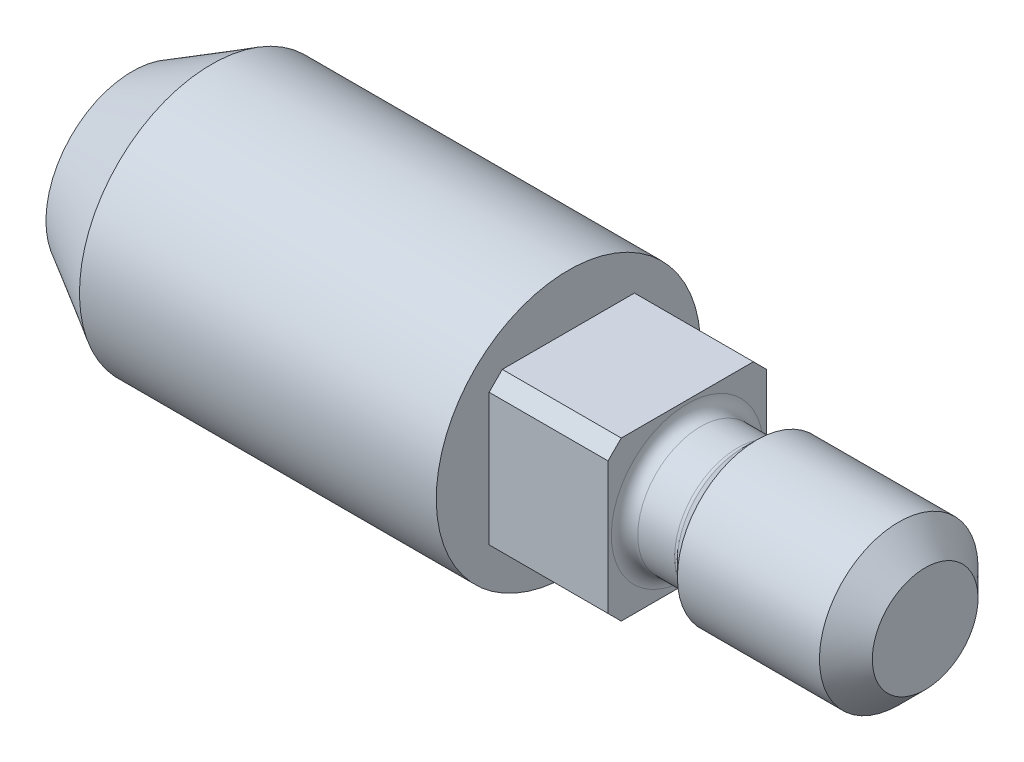
from build123d import *

# Parameters (mm, degrees)
SKETCH_2_W      = 12
SKETCH_2_H      = 12
EXTRUDE_1_DEPTH = 9
CHAMFER_1_SIZE  = 1
FILLET_1_R      = 1
FILLET_2_R      = 0.5
CHAMFER_2_SIZE  = 2


with BuildPart() as part:
    # Эскиз1 → Повернуть1 (revolve)
    with BuildSketch(Plane.XY, mode=Mode.PRIVATE) as revolve_1_sk:
        with BuildLine():
            Line((0, 6), (0, 6.535898385))
            Line((0, 6.535898385), (6, 10))
            Line((6, 10), (33, 10))
            Line((33, 10), (33, 6))
            Line((33, 6), (42, 6))
            Line((42, 6), (42, 4.75))
            Line((42, 4.75), (46, 4.75))
            Line((46, 4.75), (47.25, 6))
            Line((47.25, 6), (60, 6))
            Line((60, 6), (60, 0))
            Line((60, 0), (6, 0))
            ThreePointArc((6, 0), (4.242640687, 4.242640687), (0, 6))
        make_face()
    revolve(revolve_1_sk.sketch.rotate(Axis((0, 0, 0), (1, 0, 0)), 180), axis=Axis((0, 0, 0), (1, 0, 0)))

    # Эскиз2 → Бобышка-Вытянуть1 (add)
    with BuildSketch(Plane(origin=(33, 0, 0), x_dir=(0, 0, -1), z_dir=(1, 0, 0))):
        Rectangle(SKETCH_2_W, SKETCH_2_H)
    extrude(amount=EXTRUDE_1_DEPTH)

    # Фаска1
    chamfer_1_edges = [part.edges().sort_by_distance(p)[0] for p in [
        (37.5, -6, 6),
        (37.5, 6, 6),
        (37.5, 6, -6),
        (37.5, -6, -6),
    ]]
    chamfer(chamfer_1_edges, length=CHAMFER_1_SIZE)

    # Скругление1
    fillet_1_edges = [part.edges().sort_by_distance(p)[0] for p in [
        (42, 4.75, 0),
    ]]
    fillet(fillet_1_edges, radius=FILLET_1_R)

    # Скругление2
    fillet_2_edges = [part.edges().sort_by_distance(p)[0] for p in [
        (46, 4.75, 0),
    ]]
    fillet(fillet_2_edges, radius=FILLET_2_R)

    # Фаска2
    chamfer_2_edges = [part.edges().sort_by_distance(p)[0] for p in [
        (60, 6, 0),
    ]]
    chamfer(chamfer_2_edges, length=CHAMFER_2_SIZE)


solid = part.part
